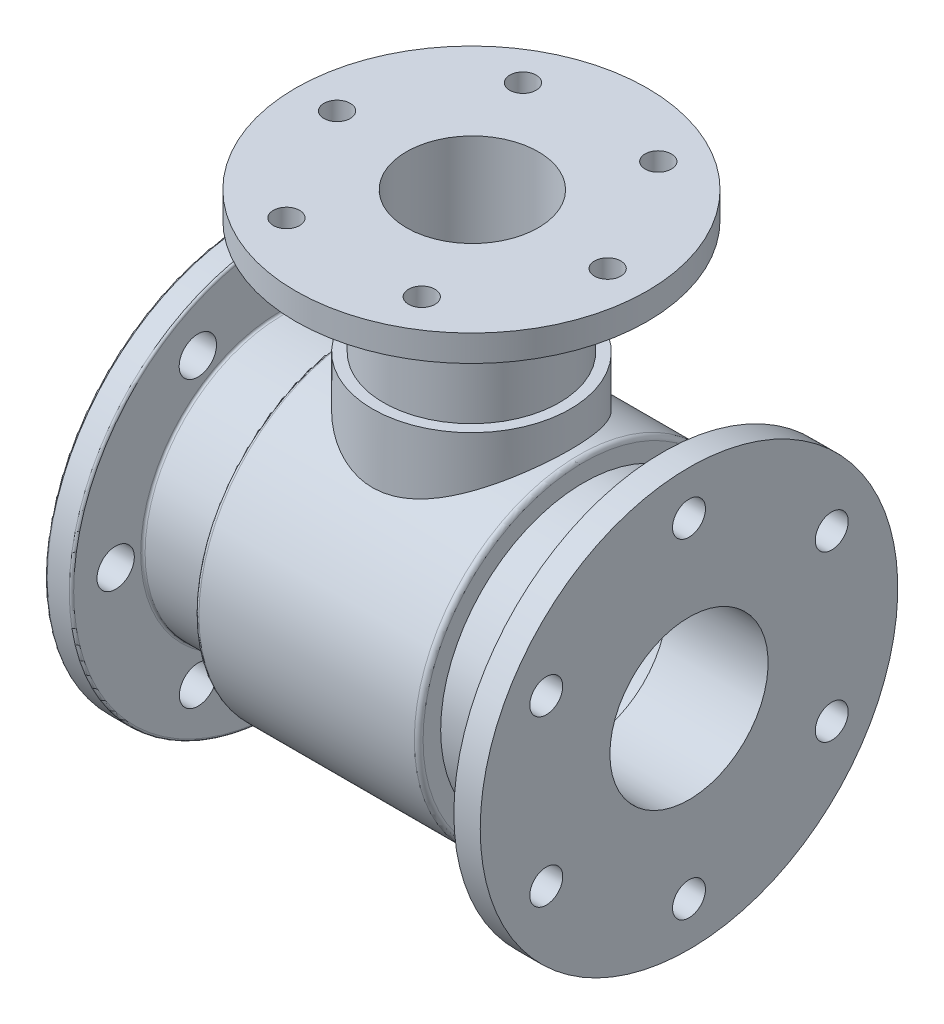
from build123d import *

# Parameters (mm, degrees)
F_12_0MM_DOWEL_HOLE1_D      = 15
F_12_0MM_DOWEL_HOLE1_DEPTH  = 12
CIRPATTERN1_COUNT           = 6
F_12_0MM_DOWEL_HOLE2_D      = 17
F_12_0MM_DOWEL_HOLE2_DEPTH  = 12
CIRPATTERN2_COUNT           = 6
BOSS_EXTRUDE1_REACH         = 220.463
BOSS_EXTRUDE1_END_RADIUS    = 75
SKETCH6_R                   = 45
F_12_0MM_DOWEL_HOLE3_REACH  = 287.322
F_12_0MM_DOWEL_HOLE3_BORE_R = 30
F_12_0MM_DOWEL_HOLE4_D      = 12
F_12_0MM_DOWEL_HOLE4_DEPTH  = 12
CIRPATTERN3_COUNT           = 6
FILLET1_R                   = 1


with BuildPart() as part:
    # Sketch1 → Revolve1 (revolve)
    with BuildSketch(Plane.XY, mode=Mode.PRIVATE) as revolve1_sk:
        with BuildLine():
            Line((-87, -47.5), (-87, -52.5))
            Line((-87, -52.5), (-99, -52.5))
            Line((-99, -52.5), (-99, -95))
            Line((-99, -95), (-87, -95))
            Line((-87, -95), (-87, -62.5))
            Line((-87, -62.5), (-51, -62.5))
            Line((-51, -62.5), (-51, -73))
            ThreePointArc((-51, -73), (-50.414213562, -74.414213562), (-49, -75))
            Line((-49, -75), (49, -75))
            ThreePointArc((49, -75), (50.414213562, -74.414213562), (51, -73))
            Line((51, -73), (51, -65))
            Line((51, -65), (73, -65))
            Line((73, -65), (73, -50))
            Line((73, -50), (87, -50))
            Line((87, -50), (87, -95))
            Line((87, -95), (99, -95))
            Line((99, -95), (99, -36))
            Line((99, -36), (53, -36))
            Line((53, -36), (53, -41.5))
            Line((53, -41.5), (51, -43.5))
            Line((51, -43.5), (36, -43.5))
            Line((36, -43.5), (36, -50.5))
            ThreePointArc((36, -50.5), (35.414213562, -51.914213562), (34, -52.5))
            Line((34, -52.5), (-34, -52.5))
            ThreePointArc((-34, -52.5), (-35.414213562, -51.914213562), (-36, -50.5))
            Line((-36, -50.5), (-36, -47.5))
            Line((-36, -47.5), (-87, -47.5))
        make_face()
    revolve(revolve1_sk.sketch.rotate(Axis((0, 0, 0), (1, 0, 0)), 270), axis=Axis((0, 0, 0), (1, 0, 0)))

    # Ø12.0mm Dowel Hole1
    with Locations(Plane(origin=(99, 0, 0), x_dir=(0, 0, -1), z_dir=(1, 0, 0))):
        with Locations((0, 75)):
            f_12_0mm_dowel_hole1 = Hole(F_12_0MM_DOWEL_HOLE1_D / 2, depth=F_12_0MM_DOWEL_HOLE1_DEPTH)

    # CirPattern1: Ø12.0mm Dowel Hole1 ×6 about axis
    cirpattern1_axis = Axis((0, 0, 0), (1, 0, 0))
    for i in range(1, CIRPATTERN1_COUNT):
        add(f_12_0mm_dowel_hole1.rotate(cirpattern1_axis, i * 360 / CIRPATTERN1_COUNT), mode=Mode.SUBTRACT)

    # Ø12.0mm Dowel Hole2
    with Locations(Plane(origin=(-99, -0.050852652, 74.897639686), x_dir=(0, 0, -1), z_dir=(-1, 0, 0))):
        with Locations((0, 0)):
            f_12_0mm_dowel_hole2 = Hole(F_12_0MM_DOWEL_HOLE2_D / 2, depth=F_12_0MM_DOWEL_HOLE2_DEPTH)

    # CirPattern2: Ø12.0mm Dowel Hole2 ×6 about axis
    cirpattern2_axis = Axis((0, 0, 0), (1, 0, 0))
    for i in range(1, CIRPATTERN2_COUNT):
        add(f_12_0mm_dowel_hole2.rotate(cirpattern2_axis, i * 360 / CIRPATTERN2_COUNT), mode=Mode.SUBTRACT)



with BuildPart() as body_2:
    # Sketch5 → Revolve2 (revolve)
    with BuildSketch(Plane.XY, mode=Mode.PRIVATE) as revolve2_sk:
        Polygon((0, 155), (80, 155), (80, 143), (40, 143), (40, 91), (45, 91), (45, 75), (0, 75), align=None)
    revolve(revolve2_sk.sketch.rotate(Axis((0, 0, 0), (0, 1, 0)), 90), axis=Axis((0, 0, 0), (0, 1, 0)))


with BuildPart() as part_1:
    add(part.part)

    add(body_2.part)  # Boss-Extrude1 merges body 2
    # Boss-Extrude1: up to this cylinder (the profile starts outside it)
    boss_extrude1_end = Plane(origin=(0, 0, 0), z_dir=(-1, 0, 0)) * Cylinder(BOSS_EXTRUDE1_END_RADIUS, 591.926, mode=Mode.PRIVATE)
    # Sketch6 → Boss-Extrude1 (add, up to the surface)
    with BuildSketch(Plane.XZ.offset(-75), mode=Mode.PRIVATE) as boss_extrude1_sk1:
        with Locations(Location((0, 0, 0), (0, 0, 90))):
            Circle(SKETCH6_R)
    boss_extrude1_tool1 = extrude(boss_extrude1_sk1.sketch, amount=BOSS_EXTRUDE1_REACH, mode=Mode.PRIVATE) - boss_extrude1_end
    add(boss_extrude1_tool1.solids().sort_by_distance((0, 75, 0))[0])
    add(boss_extrude1_tool1.solids().sort_by_distance((0, 75, 0))[1])

    # Ø12.0mm Dowel Hole3 bore (on position points) → Ø12.0mm Dowel Hole3 (cut, up to next)
    with BuildSketch(Plane(origin=(0.28239661, 155, -0.141198305), x_dir=(0, 0, 1), z_dir=(0, 1, 0)), mode=Mode.PRIVATE) as f_12_0mm_dowel_hole3_sk1:
        Circle(F_12_0MM_DOWEL_HOLE3_BORE_R)
    f_12_0mm_dowel_hole3_tool1 = extrude(f_12_0mm_dowel_hole3_sk1.sketch, amount=-F_12_0MM_DOWEL_HOLE3_REACH, mode=Mode.PRIVATE) & part_1.part
    add(f_12_0mm_dowel_hole3_tool1.solids().sort_by_distance((0.282397, 155, -0.141198))[0], mode=Mode.SUBTRACT)

    # Ø12.0mm Dowel Hole4
    with Locations(Plane(origin=(62.127254245, 155, 0.141198305), x_dir=(0, 0, 1), z_dir=(0, 1, 0))):
        with Locations((0, 0)):
            f_12_0mm_dowel_hole4 = Hole(F_12_0MM_DOWEL_HOLE4_D / 2, depth=F_12_0MM_DOWEL_HOLE4_DEPTH)

    # CirPattern3: Ø12.0mm Dowel Hole4 ×6 about axis
    cirpattern3_axis = Axis((0.28239661, 0, -0.141198305), (0, 1, 0))
    for i in range(1, CIRPATTERN3_COUNT):
        add(f_12_0mm_dowel_hole4.rotate(cirpattern3_axis, i * 360 / CIRPATTERN3_COUNT), mode=Mode.SUBTRACT)

    # Fillet1
    fillet1_edges = [part_1.edges().sort_by_distance(p)[0] for p in [
        (-51, 0, -62.5),
        (-87, 0, -62.5),
        (-87, 0, -95),
        (-99, 0, -95),
    ]]
    fillet(fillet1_edges, radius=FILLET1_R)


solid = part_1.part
